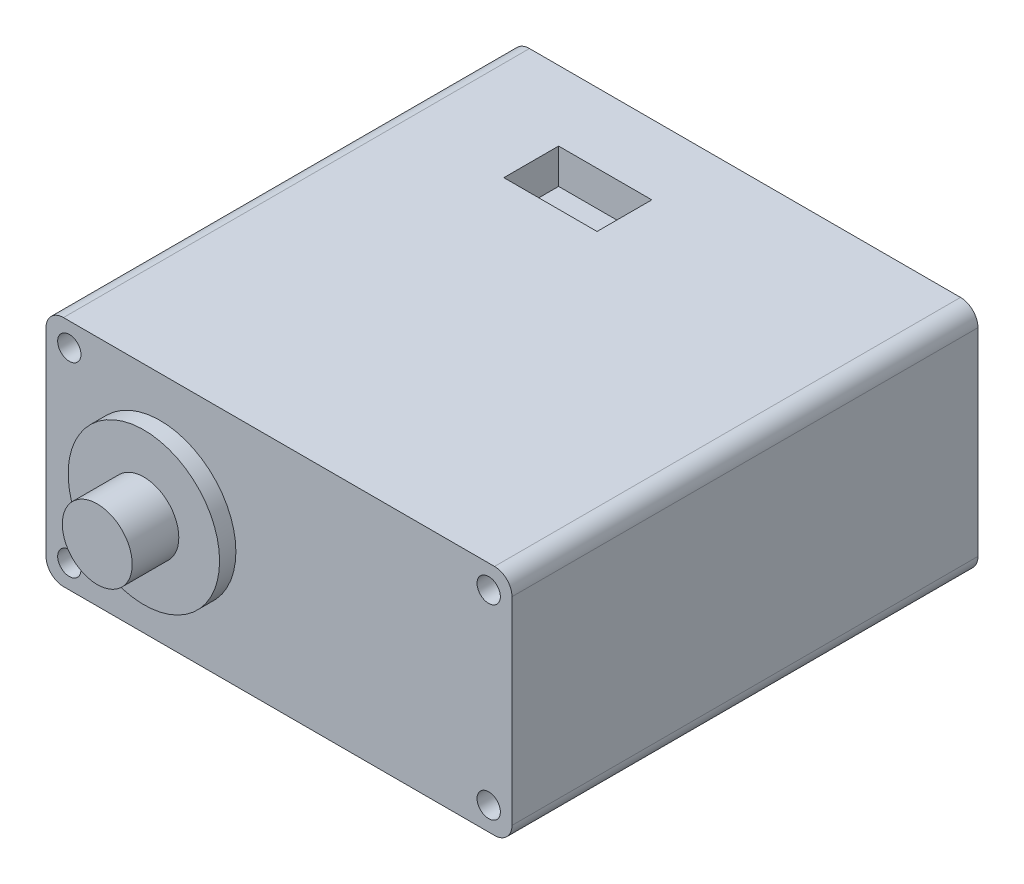
from build123d import *

# Parameters (mm, degrees)
SKETCH_1_W          = 40
SKETCH_1_H          = 20
SKETCH_1_R          = 1
EXTRUDE_1_DEPTH     = 40
FILLET_1_R          = 1.5
SKETCH_3_R          = 6.5
EXTRUDE_3_DEPTH     = 1.4
EXTRUDE_START       = 1.4
SKETCH_4_R          = 6.5
EXTRUDE_4_DEPTH     = 1.4
SKETCH_6_R          = 3
EXTRUDE_6_DEPTH     = 4
SKETCH_7_W          = 8
SKETCH_7_H          = 4.7
CUT_EXTRUDE_1_DEPTH = 3
SKETCH_8_W          = 4.7
SKETCH_8_H          = 8
CUT_EXTRUDE_2_DEPTH = 3


with BuildPart() as part:
    # 草图1 → 凸台-拉伸1 (new body)
    with BuildSketch(Plane.XY):
        with Locations((-36.575311459, 110.529011993)):
            Rectangle(SKETCH_1_W, SKETCH_1_H)
        with Locations((-54.575311459, 118.529011993)):
            Circle(SKETCH_1_R, mode=Mode.SUBTRACT)
        with Locations((-54.575311459, 102.529011993)):
            Circle(SKETCH_1_R, mode=Mode.SUBTRACT)
        with Locations((-18.575311459, 102.529011993)):
            Circle(SKETCH_1_R, mode=Mode.SUBTRACT)
        with Locations((-18.575311459, 118.529011993)):
            Circle(SKETCH_1_R, mode=Mode.SUBTRACT)
    extrude(amount=EXTRUDE_1_DEPTH)

    # 圆角1
    fillet_1_edges = [part.edges().sort_by_distance(p)[0] for p in [
        (-16.575311459, 100.529011993, 20),
        (-56.575311459, 100.529011993, 20),
        (-56.575311459, 120.529011993, 20),
        (-16.575311459, 120.529011993, 20),
    ]]
    fillet(fillet_1_edges, radius=FILLET_1_R)

    # 草图3 → 凸台-拉伸3 (add)
    with BuildSketch(Plane.XY.offset(40)):
        with Locations((-46.775311459, 110.529011993)):
            Circle(SKETCH_3_R)
    extrude(amount=EXTRUDE_3_DEPTH)

    # 草图4 → 凸台-拉伸4 (add)
    with BuildSketch(Plane(origin=(0, 0, 0), x_dir=(-1, 0, 0), z_dir=(0, 0, -1)).offset(EXTRUDE_START)):
        with Locations(Location((46.775311459, 110.529011993, 0), (0, 0, 180))):
            Circle(SKETCH_4_R)
    extrude(amount=-EXTRUDE_4_DEPTH)

    # 草图6 → 凸台-拉伸6 (add)
    with BuildSketch(Plane.XY.offset(41.4)):
        with Locations((-46.775311459, 110.529011993)):
            Circle(SKETCH_6_R)
    extrude(amount=EXTRUDE_6_DEPTH)

    # 草图7 → 切除-拉伸1 (cut)
    with BuildSketch(Plane.XZ.offset(-100.529011993)):
        with Locations((-42.575311459, 8.35)):
            Rectangle(SKETCH_7_W, SKETCH_7_H)
    cut_extrude_1 = extrude(amount=-CUT_EXTRUDE_1_DEPTH, mode=Mode.SUBTRACT)

    # 镜向1: 切除-拉伸1 across plane
    add(cut_extrude_1.mirror(Plane(origin=(0, 110.529011993, 0), x_dir=(0, 0, 1), z_dir=(0, -1, 0))), mode=Mode.SUBTRACT)

    # 草图8 → 切除-拉伸2 (cut)
    with BuildSketch(Plane.ZY.offset(56.575311459)):
        with Locations((8.35, 110.529011993)):
            Rectangle(SKETCH_8_W, SKETCH_8_H)
    extrude(amount=-CUT_EXTRUDE_2_DEPTH, mode=Mode.SUBTRACT)


solid = part.part
